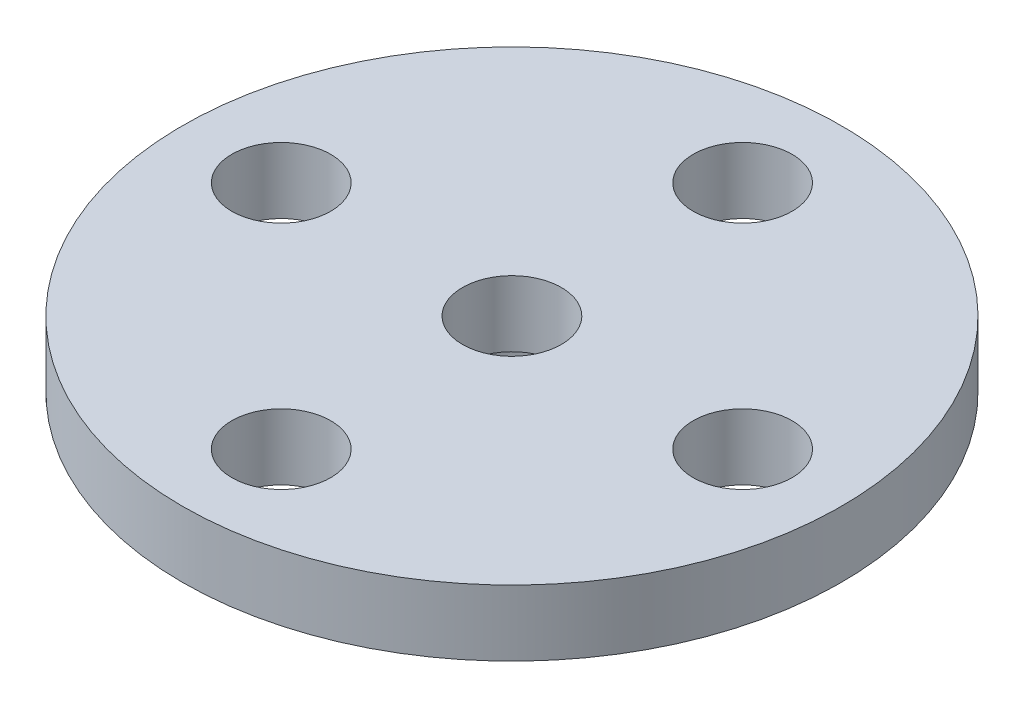
from build123d import *

# Parameters (mm, degrees)
SKETCH_1_R      = 10
SKETCH_1_R_2    = 1.5
EXTRUDE_1_DEPTH = 2
SKETCH_2_R      = 4.5
SKETCH_2_R_2    = 2.75
EXTRUDE_2_DEPTH = 2.5


with BuildPart() as part:
    # 草图1 → 凸台-拉伸1 (new body)
    with BuildSketch(Plane(origin=(0, 0, 0), x_dir=(1, 0, 0), z_dir=(0, 1, 0))):
        with Locations(Location((0, 0, 0), (0, 0, 270))):
            Circle(SKETCH_1_R)
        with Locations(Location((-7, 0, 0), (0, 0, 270))):
            Circle(SKETCH_1_R_2, mode=Mode.SUBTRACT)
        with Locations(Location((0, 7, 0), (0, 0, 270))):
            Circle(SKETCH_1_R_2, mode=Mode.SUBTRACT)
        with Locations(Location((7, 0, 0), (0, 0, 270))):
            Circle(SKETCH_1_R_2, mode=Mode.SUBTRACT)
        with Locations(Location((0, -7, 0), (0, 0, 270))):
            Circle(SKETCH_1_R_2, mode=Mode.SUBTRACT)
        with Locations(Location((0, 0, 0), (0, 0, 270))):
            Circle(SKETCH_1_R_2, mode=Mode.SUBTRACT)
    extrude(amount=EXTRUDE_1_DEPTH)

    # 草图2 → 凸台-拉伸2 (add)
    with BuildSketch(Plane(origin=(0, 0, 0), x_dir=(1, 0, 0), z_dir=(0, 1, 0))):
        with Locations(Location((0, 0, 0), (0, 0, 270))):
            Circle(SKETCH_2_R)
        with Locations(Location((0, 0, 0), (0, 0, 270))):
            Circle(SKETCH_2_R_2, mode=Mode.SUBTRACT)
    extrude(amount=-EXTRUDE_2_DEPTH)


solid = part.part
